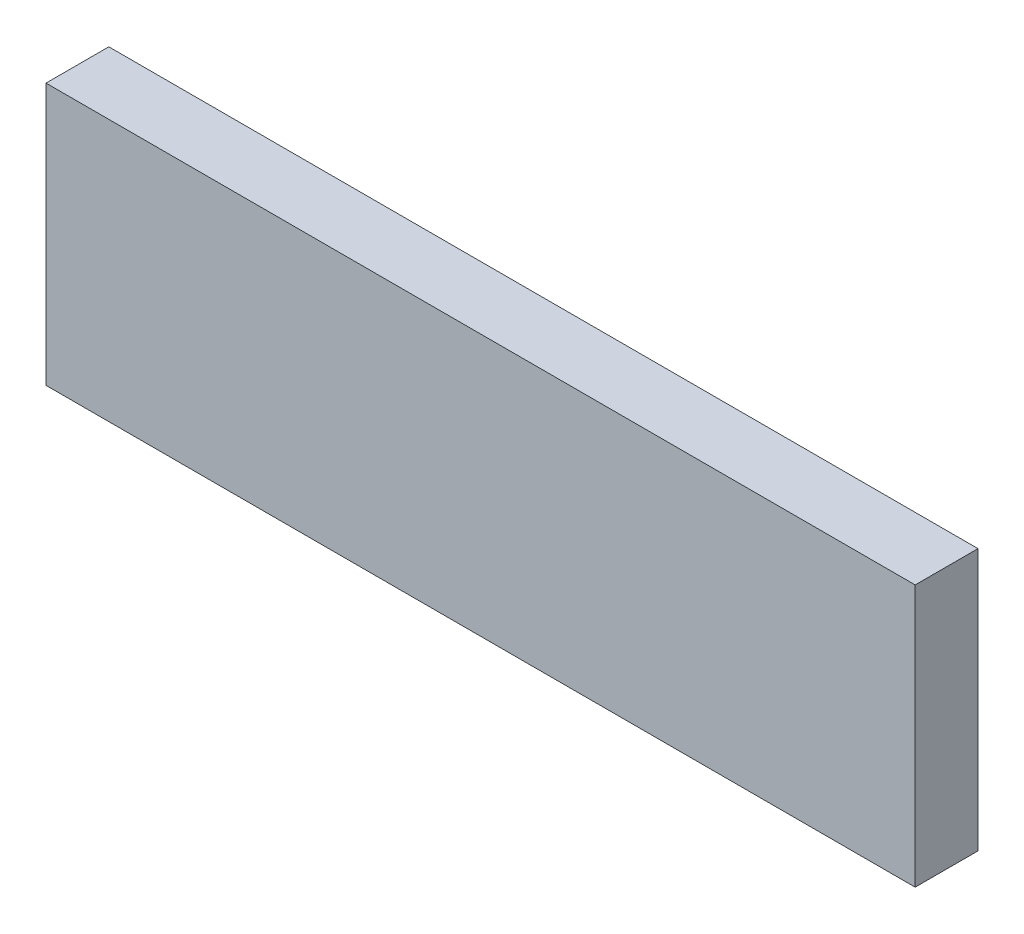
from build123d import *

# Parameters (mm, degrees)
SKETCH3_W           = 166
SKETCH3_H           = 50
BOSS_EXTRUDE2_DEPTH = 12


with BuildPart() as part:
    # Sketch3 → Boss-Extrude2 (new body)
    with BuildSketch(Plane.XY):
        with Locations((500, 25)):
            Rectangle(SKETCH3_W, SKETCH3_H)
    extrude(amount=BOSS_EXTRUDE2_DEPTH)


solid = part.part
